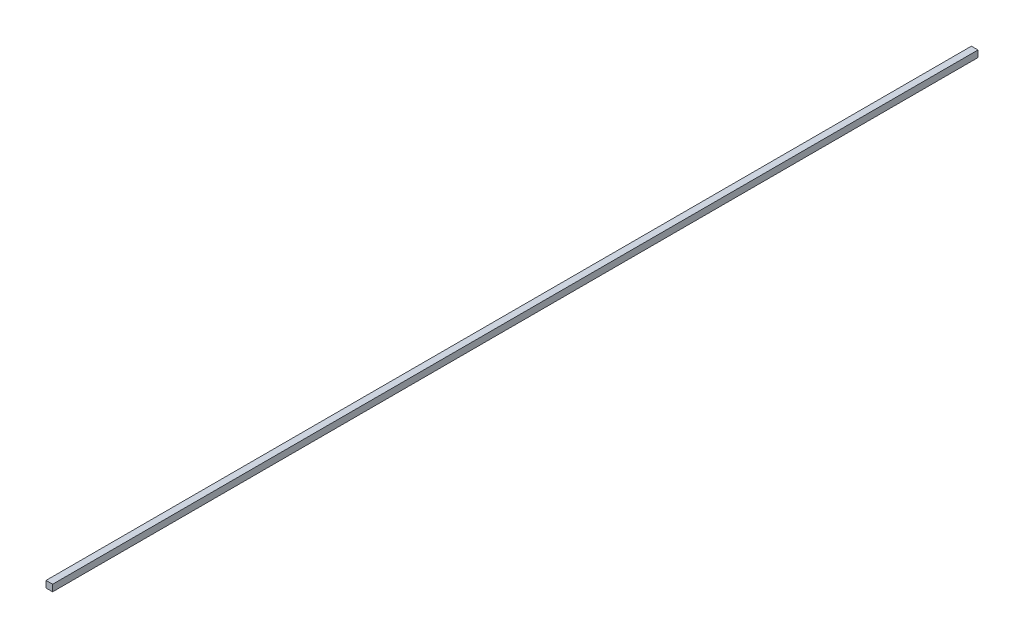
from build123d import *

# Parameters (mm, degrees)
ESQUISSE2_W        = 10
ESQUISSE2_H        = 10
BOSS_EXTRU_1_DEPTH = 700


with BuildPart() as part:
    # Esquisse2 → Boss.-Extru.1 (new, symmetric)
    with BuildSketch(Plane.XY):
        Rectangle(ESQUISSE2_W, ESQUISSE2_H)
    extrude(amount=BOSS_EXTRU_1_DEPTH, both=True)


solid = part.part
